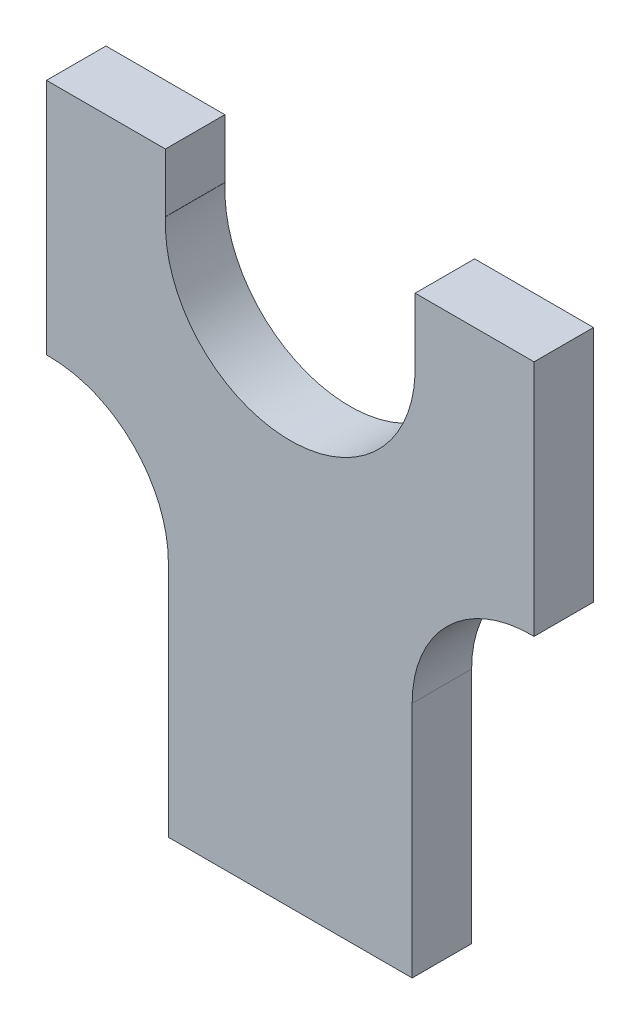
from build123d import *

# Parameters (mm, degrees)
BOSS_EXTRUDE2_DEPTH = 50
CUT_EXTRUDE2_START  = -102.5
SKETCH2_R           = 3.05
CUT_EXTRUDE2_DEPTH  = 6
CUT_EXTRUDE3_START  = 96.5
SKETCH2_2_R         = 3.05
CUT_EXTRUDE3_DEPTH  = 6
BOSS_EXTRUDE3_DEPTH = 50
SKETCH5_R           = 105
CUT_EXTRUDE6_DEPTH  = 543.701575454
SKETCH8_W           = 210
SKETCH8_H           = 49.303912119
CUT_EXTRUDE7_DEPTH  = 543.701575454


with BuildPart() as part:
    # Sketch1 → Boss-Extrude2 (new body)
    with BuildSketch(Plane.XY):
        with BuildLine():
            Line((102.5, 0), (-102.5, 0))
            Line((-102.5, 0), (-102.5, 200))
            ThreePointArc((-102.5, 200), (-131.789321881, 270.710678119), (-202.5, 300))
            Line((-202.5, 300), (-205, 300))
            Line((-205, 300), (-205, 490))
            ThreePointArc((-205, 490), (-202.071067812, 497.071067812), (-195, 500))
            Line((-195, 500), (-112.5, 500))
            ThreePointArc((-112.5, 500), (-105.428932188, 497.071067812), (-102.5, 490))
            Line((-102.5, 490), (-102.5, 400.25))
            ThreePointArc((-102.5, 400.25), (-102.426776695, 400.073223305), (-102.25, 400))
            Line((-102.25, 400), (102.25, 400))
            ThreePointArc((102.25, 400), (102.426776695, 400.073223305), (102.5, 400.25))
            Line((102.5, 400.25), (102.5, 490))
            ThreePointArc((102.5, 490), (105.428932188, 497.071067812), (112.5, 500))
            Line((112.5, 500), (195, 500))
            ThreePointArc((195, 500), (202.071067812, 497.071067812), (205, 490))
            Line((205, 490), (205, 300))
            Line((205, 300), (202.5, 300))
            ThreePointArc((202.5, 300), (131.789321881, 270.710678119), (102.5, 200))
            Line((102.5, 200), (102.5, 0))
        make_face()
    extrude(amount=BOSS_EXTRUDE2_DEPTH)

    # Sketch2 → Cut-Extrude2 (cut)
    with BuildSketch(Plane(origin=(0, 0, 0), x_dir=(0, 0, -1), z_dir=(1, 0, 0)).offset(CUT_EXTRUDE2_START)):
        with Locations(Location((-25, 30, 0), (0, 0, 180))):
            Circle(SKETCH2_R)
        with Locations(Location((-25, 90, 0), (0, 0, 180))):
            Circle(SKETCH2_R)
        with Locations(Location((-25, 150, 0), (0, 0, 180))):
            Circle(SKETCH2_R)
    extrude(amount=CUT_EXTRUDE2_DEPTH, mode=Mode.SUBTRACT)

    # Sketch2<2> → Cut-Extrude3 (cut)
    with BuildSketch(Plane(origin=(0, 0, 0), x_dir=(0, 0, -1), z_dir=(1, 0, 0)).offset(CUT_EXTRUDE3_START)):
        with Locations(Location((-25, 30, 0), (0, 0, 180))):
            Circle(SKETCH2_2_R)
        with Locations(Location((-25, 90, 0), (0, 0, 180))):
            Circle(SKETCH2_2_R)
        with Locations(Location((-25, 150, 0), (0, 0, 180))):
            Circle(SKETCH2_2_R)
    extrude(amount=CUT_EXTRUDE3_DEPTH, mode=Mode.SUBTRACT)

    # Sketch6 → Boss-Extrude3 (add)
    with BuildSketch(Plane.XY):
        with BuildLine():
            Line((202.5, 300), (205, 300))
            Line((205, 300), (205, 500))
            Line((205, 500), (-205, 500))
            Line((-205, 500), (-205, 300))
            Line((-205, 300), (-202.5, 300))
            ThreePointArc((-202.5, 300), (-131.789321881, 270.710678119), (-102.5, 200))
            Line((-102.5, 200), (-102.5, 0))
            Line((-102.5, 0), (102.5, 0))
            Line((102.5, 0), (102.5, 200))
            ThreePointArc((102.5, 200), (131.789321881, 270.710678119), (202.5, 300))
        make_face()
    extrude(amount=BOSS_EXTRUDE3_DEPTH)

    # Sketch5 → Cut-Extrude6 (cut, through all)
    with BuildSketch(Plane.XY):
        with Locations((0, 445.125)):
            Circle(SKETCH5_R)
    extrude(amount=CUT_EXTRUDE6_DEPTH, mode=Mode.SUBTRACT)

    # Sketch8 → Cut-Extrude7 (cut, through all)
    with BuildSketch(Plane.XY):
        with Locations((0, 475.348043941)):
            Rectangle(SKETCH8_W, SKETCH8_H)
    extrude(amount=CUT_EXTRUDE7_DEPTH, mode=Mode.SUBTRACT)


solid = part.part
